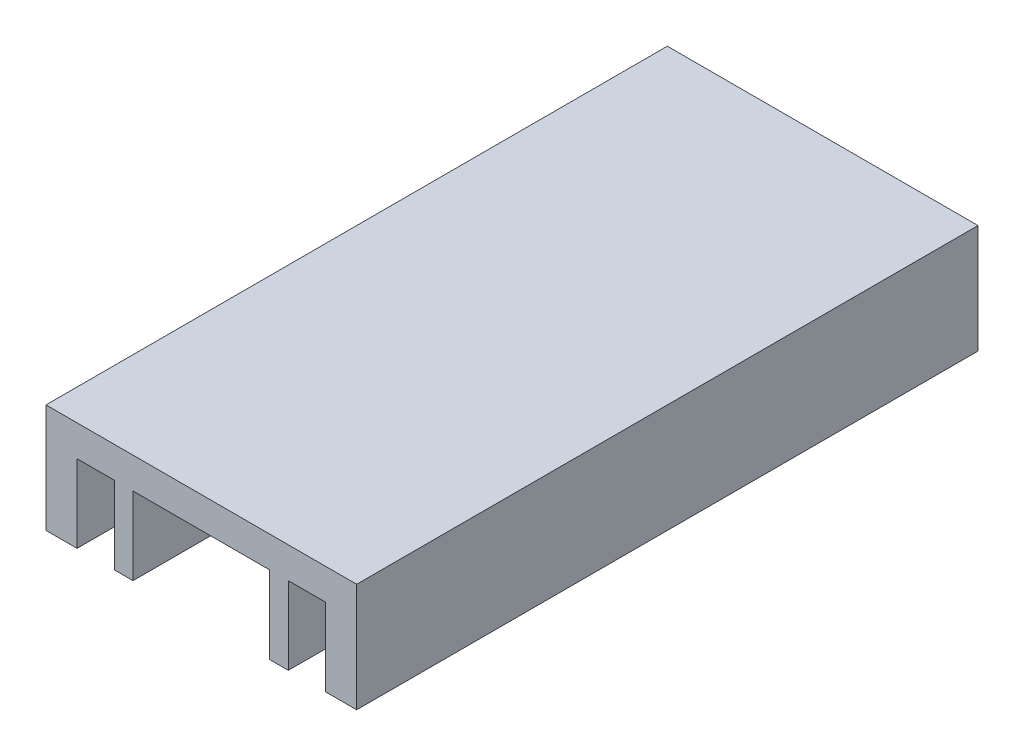
from build123d import *

# Parameters (mm, degrees)
BOSS_EXTRUDE1_DEPTH = 20


with BuildPart() as part:
    # Sketch1 → Boss-Extrude1 (new body)
    with BuildSketch(Plane.XY):
        Polygon((-3, 6.5), (-4, 6.5), (-4, 10), (6, 10), (6, 6.5), (5, 6.5), (5, 9), (3.8, 9), (3.8, 6.5), (3.2, 6.5), (3.2, 9), (-1.2, 9), (-1.2, 6.5), (-1.8, 6.5), (-1.8, 9), (-3, 9), align=None)
    extrude(amount=BOSS_EXTRUDE1_DEPTH)


solid = part.part
